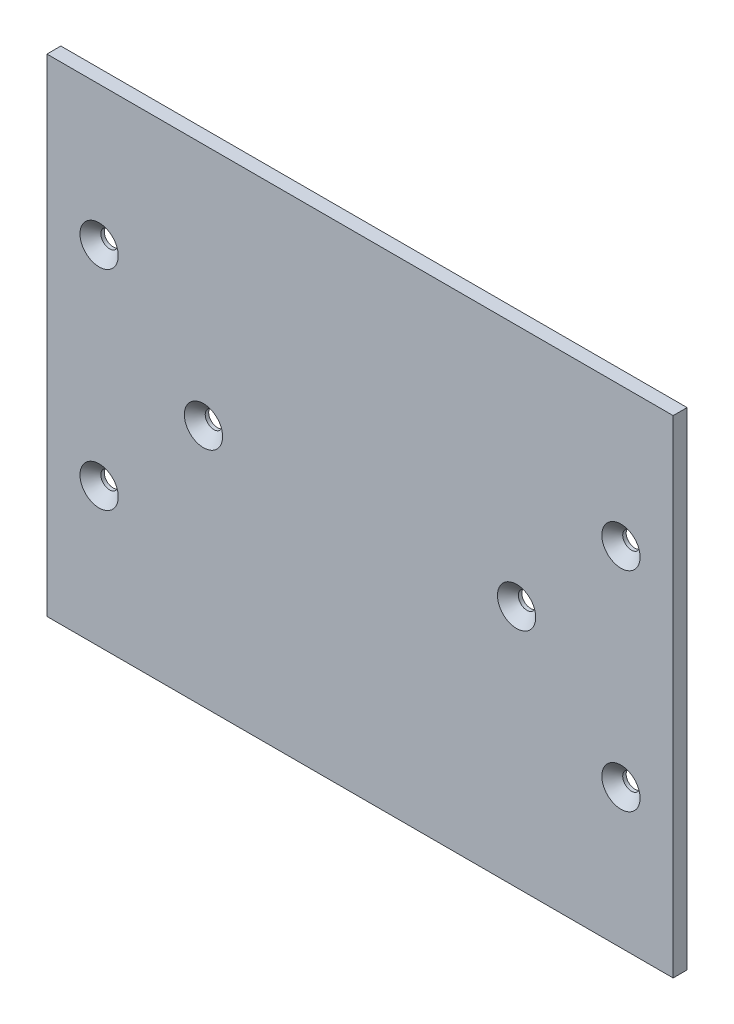
from build123d import *

# Parameters (mm, degrees)
SKETCH1_W           = 180
SKETCH1_H           = 140
BOSS_EXTRUDE1_DEPTH = 4
CUT_EXTRUDE1_REACH  = 116.088
SKETCH2_R           = 2.5
CHAMFER1_SIZE       = 3


with BuildPart() as part:
    # Sketch1 → Boss-Extrude1 (new body)
    with BuildSketch(Plane.XY):
        Rectangle(SKETCH1_W, SKETCH1_H)
    extrude(amount=BOSS_EXTRUDE1_DEPTH)

    # Sketch2 → Cut-Extrude1 (cut, up to next)
    with BuildSketch(Plane(origin=(0, 0, 0), x_dir=(-1, 0, 0), z_dir=(0, 0, -1)), mode=Mode.PRIVATE) as cut_extrude1_sk1:
        with Locations((-75, 30)):
            Circle(SKETCH2_R)
    cut_extrude1_tool1 = extrude(cut_extrude1_sk1.sketch, amount=-CUT_EXTRUDE1_REACH, mode=Mode.PRIVATE) & part.part
    # Sketch2 → Cut-Extrude1 (cut, up to next)
    with BuildSketch(Plane(origin=(0, 0, 0), x_dir=(-1, 0, 0), z_dir=(0, 0, -1)), mode=Mode.PRIVATE) as cut_extrude1_sk2:
        with Locations((-75, -30)):
            Circle(SKETCH2_R)
    cut_extrude1_tool2 = extrude(cut_extrude1_sk2.sketch, amount=-CUT_EXTRUDE1_REACH, mode=Mode.PRIVATE) & part.part
    # Sketch2 → Cut-Extrude1 (cut, up to next)
    with BuildSketch(Plane(origin=(0, 0, 0), x_dir=(-1, 0, 0), z_dir=(0, 0, -1)), mode=Mode.PRIVATE) as cut_extrude1_sk3:
        with Locations((75, -30)):
            Circle(SKETCH2_R)
    cut_extrude1_tool3 = extrude(cut_extrude1_sk3.sketch, amount=-CUT_EXTRUDE1_REACH, mode=Mode.PRIVATE) & part.part
    # Sketch2 → Cut-Extrude1 (cut, up to next)
    with BuildSketch(Plane(origin=(0, 0, 0), x_dir=(-1, 0, 0), z_dir=(0, 0, -1)), mode=Mode.PRIVATE) as cut_extrude1_sk4:
        with Locations((75, 30)):
            Circle(SKETCH2_R)
    cut_extrude1_tool4 = extrude(cut_extrude1_sk4.sketch, amount=-CUT_EXTRUDE1_REACH, mode=Mode.PRIVATE) & part.part
    # Sketch2 → Cut-Extrude1 (cut, up to next)
    with BuildSketch(Plane(origin=(0, 0, 0), x_dir=(-1, 0, 0), z_dir=(0, 0, -1)), mode=Mode.PRIVATE) as cut_extrude1_sk5:
        with Locations((45, 0)):
            Circle(SKETCH2_R)
    cut_extrude1_tool5 = extrude(cut_extrude1_sk5.sketch, amount=-CUT_EXTRUDE1_REACH, mode=Mode.PRIVATE) & part.part
    # Sketch2 → Cut-Extrude1 (cut, up to next)
    with BuildSketch(Plane(origin=(0, 0, 0), x_dir=(-1, 0, 0), z_dir=(0, 0, -1)), mode=Mode.PRIVATE) as cut_extrude1_sk6:
        with Locations((-45, 0)):
            Circle(SKETCH2_R)
    cut_extrude1_tool6 = extrude(cut_extrude1_sk6.sketch, amount=-CUT_EXTRUDE1_REACH, mode=Mode.PRIVATE) & part.part
    add(cut_extrude1_tool1.solids().sort_by_distance((75, 30, 0))[0], mode=Mode.SUBTRACT)
    add(cut_extrude1_tool2.solids().sort_by_distance((75, -30, 0))[0], mode=Mode.SUBTRACT)
    add(cut_extrude1_tool3.solids().sort_by_distance((-75, -30, 0))[0], mode=Mode.SUBTRACT)
    add(cut_extrude1_tool4.solids().sort_by_distance((-75, 30, 0))[0], mode=Mode.SUBTRACT)
    add(cut_extrude1_tool5.solids().sort_by_distance((-45, 0, 0))[0], mode=Mode.SUBTRACT)
    add(cut_extrude1_tool6.solids().sort_by_distance((45, 0, 0))[0], mode=Mode.SUBTRACT)

    # Chamfer1
    chamfer1_edges = [part.edges().sort_by_distance(p)[0] for p in [
        (77.5, 30, 4),
        (77.5, -30, 4),
        (-72.5, -30, 4),
        (-72.5, 30, 4),
        (-42.5, 0, 4),
        (47.5, 0, 4),
    ]]
    chamfer(chamfer1_edges, length=CHAMFER1_SIZE)


solid = part.part
